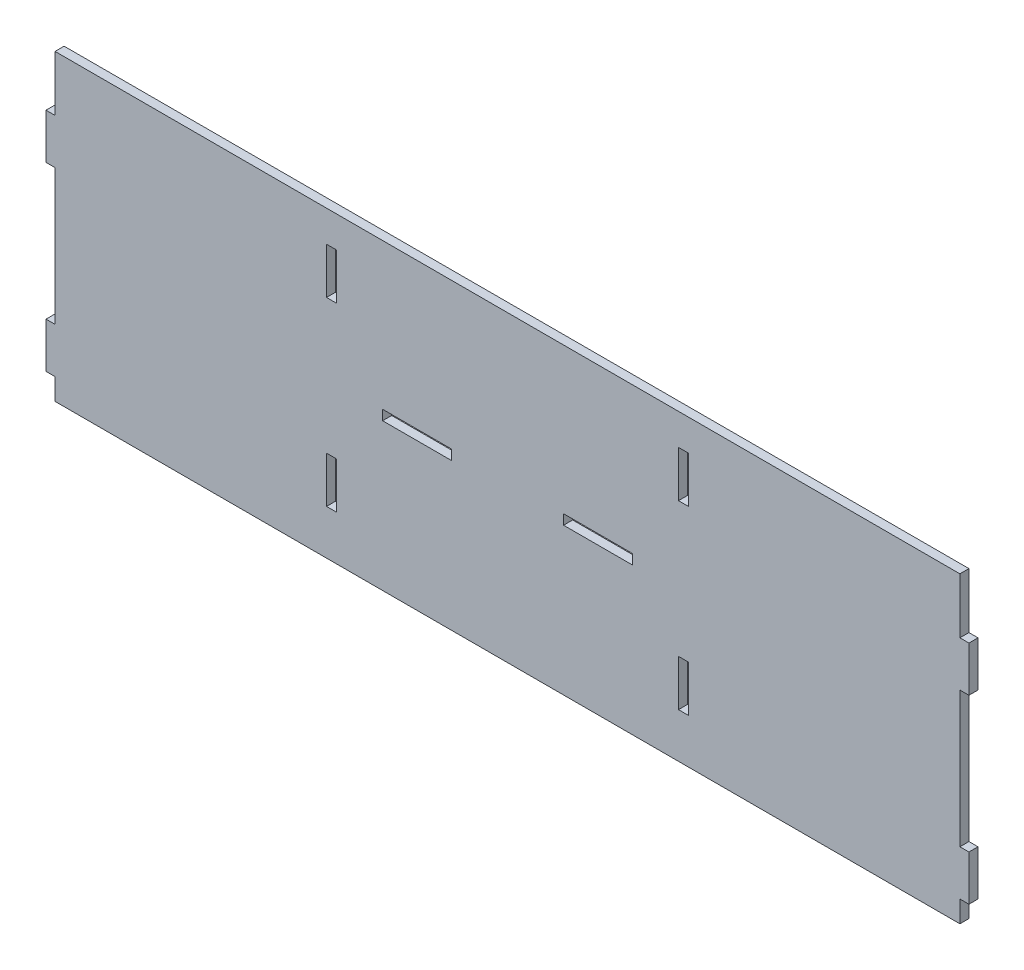
from build123d import *

# Parameters (mm, degrees)
SKETCH_1_W      = 4.4
SKETCH_1_H      = 20.4
SKETCH_1_W_2    = 30.4
SKETCH_1_H_2    = 4.4
EXTRUDE_1_DEPTH = 4


with BuildPart() as part:
    # Эскиз1 → Бобышка-Вытянуть1 (new body)
    with BuildSketch(Plane.XY):
        Polygon((0, 9.5), (0, 0), (400, 0), (400, 9.5), (404, 9.5), (404, 29.5), (400, 29.5), (400, 89.5), (404, 89.5), (404, 109.5), (400, 109.5), (400, 134), (0, 134), (0, 109.5), (-4, 109.5), (-4, 89.5), (0, 89.5), (0, 29.5), (-4, 29.5), (-4, 9.5), align=None)
        with Locations((122.2, 30)):
            Rectangle(SKETCH_1_W, SKETCH_1_H, mode=Mode.SUBTRACT)
        with Locations((277.8, 30)):
            Rectangle(SKETCH_1_W, SKETCH_1_H, mode=Mode.SUBTRACT)
        with Locations((160, 67.2)):
            Rectangle(SKETCH_1_W_2, SKETCH_1_H_2, mode=Mode.SUBTRACT)
        with Locations((122.2, 110)):
            Rectangle(SKETCH_1_W, SKETCH_1_H, mode=Mode.SUBTRACT)
        with Locations((240, 67.2)):
            Rectangle(SKETCH_1_W_2, SKETCH_1_H_2, mode=Mode.SUBTRACT)
        with Locations((277.8, 110)):
            Rectangle(SKETCH_1_W, SKETCH_1_H, mode=Mode.SUBTRACT)
    extrude(amount=EXTRUDE_1_DEPTH)


solid = part.part
